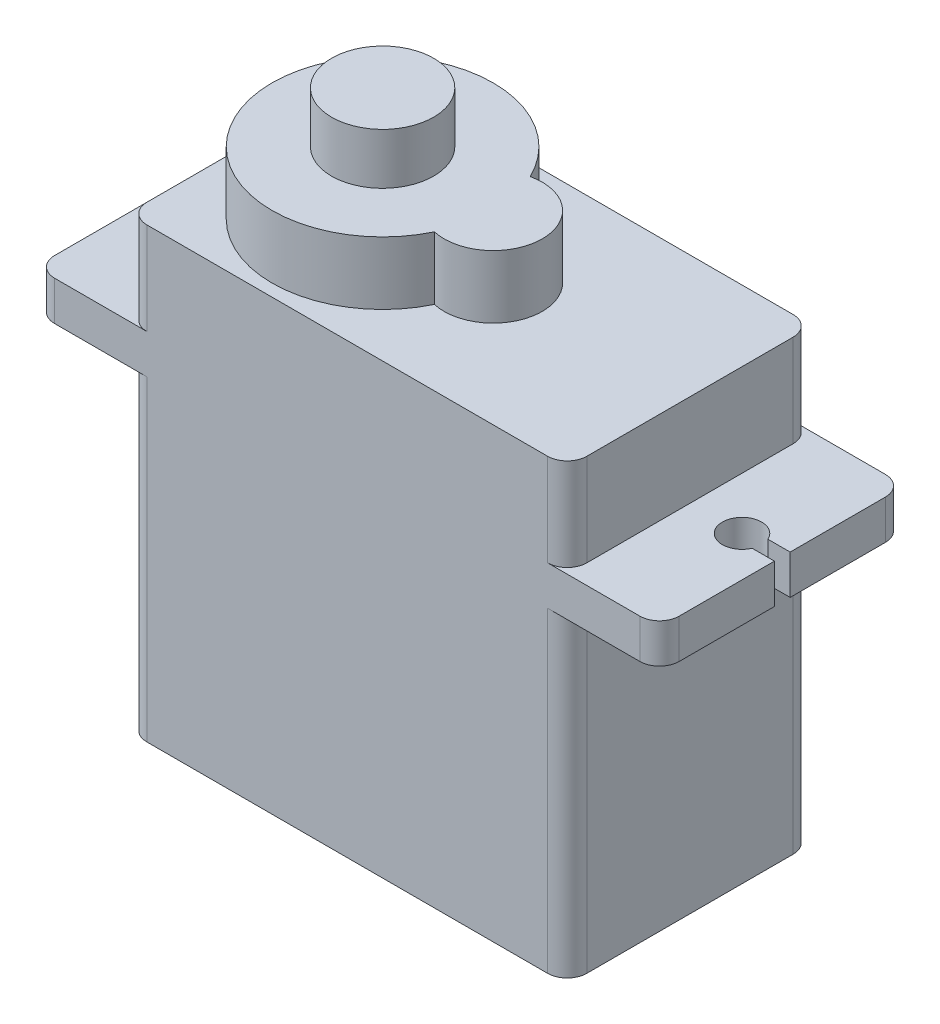
from build123d import *

# Parameters (mm, degrees)
SKETCH1_W                = 22.4
SKETCH1_H                = 12.5
BOSS_EXTRUDE1_DEPTH      = 11.4
SKETCH2_R                = 5.63
SKETCH2_R_2              = 2.5
BOSS_EXTRUDE2_DEPTH      = 3.2
BOSS_EXTRUDE3_DEPTH      = 6.25
BOSS_EXTRUDE3_DEPTH_BACK = 6.25
SKETCH3_W                = 31.8
SKETCH3_H                = 2
SKETCH4_R                = 1
CUT_EXTRUDE1_DEPTH       = 25.889405377
CUT_EXTRUDE2_DEPTH       = 25.889405377
SKETCH6_R                = 2.6
BOSS_EXTRUDE4_DEPTH      = 2.6
FILLET1_R                = 1


with BuildPart() as part:
    # Sketch1 → Boss-Extrude1 (new, symmetric)
    with BuildSketch(Plane(origin=(0, 0, 0), x_dir=(1, 0, 0), z_dir=(0, 1, 0))):
        Rectangle(SKETCH1_W, SKETCH1_H)
    extrude(amount=BOSS_EXTRUDE1_DEPTH, both=True)

    # Sketch2 → Boss-Extrude2 (add)
    with BuildSketch(Plane(origin=(0, 11.4, 0), x_dir=(1, 0, 0), z_dir=(0, 1, 0))):
        with Locations((-4.45, 0)):
            Circle(SKETCH2_R)
        with Locations((1.18, 0)):
            Circle(SKETCH2_R_2)
    extrude(amount=BOSS_EXTRUDE2_DEPTH)

    # Sketch3 → Boss-Extrude3 (add, two sides: drawn at the far end of the back side and taken through both)
    with BuildSketch(Plane.XY.offset(-BOSS_EXTRUDE3_DEPTH_BACK)):
        with Locations((0, 5.7)):
            Rectangle(SKETCH3_W, SKETCH3_H)
    extrude(amount=BOSS_EXTRUDE3_DEPTH + BOSS_EXTRUDE3_DEPTH_BACK)

    # Sketch4 → Cut-Extrude1 (cut, through all)
    with BuildSketch(Plane(origin=(0, 6.7, 0), x_dir=(1, 0, 0), z_dir=(0, 1, 0))):
        with Locations(Location((-13.85, 0, 0), (0, 0, 270))):
            Circle(SKETCH4_R)
        with Locations(Location((13.85, 0, 0), (0, 0, 270))):
            Circle(SKETCH4_R)
    extrude(amount=-CUT_EXTRUDE1_DEPTH, mode=Mode.SUBTRACT)

    # Sketch5 → Cut-Extrude2 (cut, through all)
    with BuildSketch(Plane(origin=(0, 6.7, 0), x_dir=(1, 0, 0), z_dir=(0, 1, 0))):
        with BuildLine():
            Line((-17.95, 0.4), (-13.85, 0.4))
            ThreePointArc((-13.85, 0.4), (-13.45, 0), (-13.85, -0.4))
            Line((-13.85, -0.4), (-17.95, -0.4))
            ThreePointArc((-17.95, -0.4), (-18.35, 0), (-17.95, 0.4))
        make_face()
        with BuildLine():
            Line((17.95, -0.4), (13.85, -0.4))
            ThreePointArc((13.85, -0.4), (13.45, 0), (13.85, 0.4))
            Line((13.85, 0.4), (17.95, 0.4))
            ThreePointArc((17.95, 0.4), (18.35, 0), (17.95, -0.4))
        make_face()
    extrude(amount=-CUT_EXTRUDE2_DEPTH, mode=Mode.SUBTRACT)

    # Sketch6 → Boss-Extrude4 (add)
    with BuildSketch(Plane(origin=(0, 14.6, 0), x_dir=(1, 0, 0), z_dir=(0, 1, 0))):
        with Locations(Location((-4.45, 0, 0), (0, 0, 270))):
            Circle(SKETCH6_R)
    extrude(amount=BOSS_EXTRUDE4_DEPTH)

    # Fillet1
    fillet1_edges = [part.edges().sort_by_distance(p)[0] for p in [
        (11.2, -3.35, 6.25),
        (-11.2, -3.35, 6.25),
        (-11.2, -3.35, -6.25),
        (11.2, -3.35, -6.25),
        (15.9, 5.7, 6.25),
        (-15.9, 5.7, 6.25),
        (-15.9, 5.7, -6.25),
        (15.9, 5.7, -6.25),
        (11.2, 9.05, 6.25),
        (-11.2, 9.05, 6.25),
        (-11.2, 9.05, -6.25),
        (11.2, 9.05, -6.25),
    ]]
    fillet(fillet1_edges, radius=FILLET1_R)

    # Sweep1: sweep along a path in Sketch8
    with BuildLine(Plane.XY) as sweep1_path:
        Line((-11.2, -7.4), (-12.7, -7.4))
        ThreePointArc((-12.7, -7.4), (-14.936067977, -8.781966011), (-14.7, -11.4))
    # Sketch7 → Sweep1 (sweep)
    with BuildSketch(Plane.ZY.offset(11.2)):
        with BuildLine():
            ThreePointArc((0.25, -6.966987298), (0, -6.9), (-0.25, -6.966987298))
            ThreePointArc((-0.25, -6.966987298), (-1, -7.4), (-0.25, -7.833012702))
            ThreePointArc((-0.25, -7.833012702), (0, -7.9), (0.25, -7.833012702))
            ThreePointArc((0.25, -7.833012702), (1, -7.4), (0.25, -6.966987298))
        make_face()
    sweep(path=sweep1_path.line)


solid = part.part
